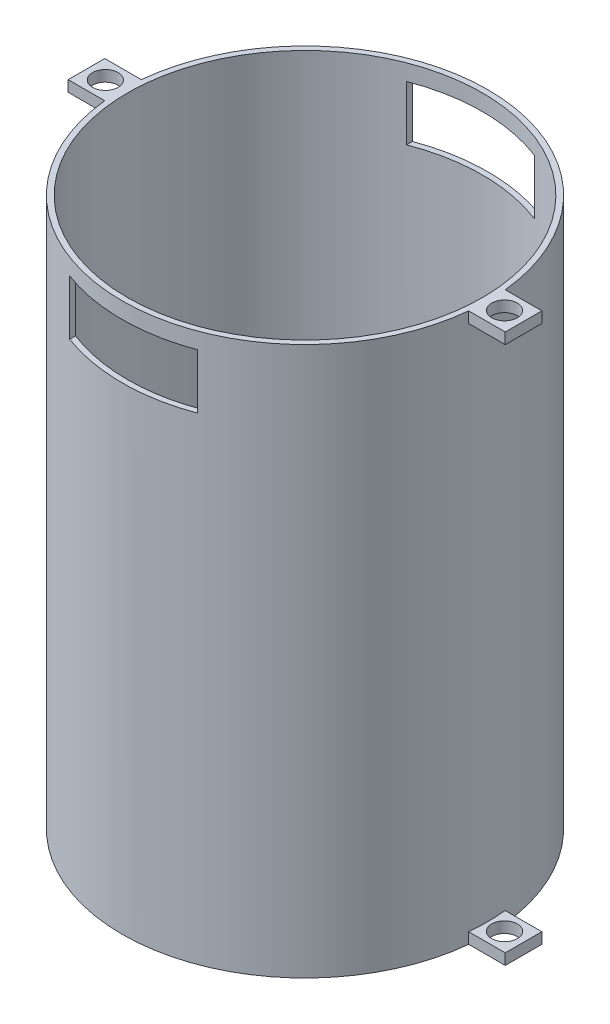
from build123d import *

# Parameters (mm, degrees)
SKETCH2_R               = 50
BOSS_EXTRUDE1_DEPTH     = 150
SKETCH3_R               = 48
CUT_EXTRUDE1_DEPTH      = 150
SKETCH4_W               = 10
SKETCH4_H               = 10
BOSS_EXTRUDE2_DEPTH     = 3
SKETCH5_W               = 10
SKETCH5_H               = 10
BOSS_EXTRUDE3_DEPTH     = 3
SKETCH7_W               = 10
SKETCH7_H               = 10
BOSS_EXTRUDE5_DEPTH     = 3
SKETCH8_W               = 10
SKETCH8_H               = 10
BOSS_EXTRUDE6_DEPTH     = 3
SKETCH9_R               = 3.5
CUT_EXTRUDE2_DEPTH      = 200
SKETCH10_R              = 3.5
CUT_EXTRUDE3_DEPTH      = 200
CUT_EXTRUDE4_DEPTH      = 150
CUT_EXTRUDE4_DEPTH_BACK = 150
SKETCH11_W              = 35
SKETCH11_H              = 15
SKETCH12_R              = 48.5
CUT_EXTRUDE5_DEPTH      = 150


with BuildPart() as part:
    # Sketch2 → Boss-Extrude1 (new body)
    with BuildSketch(Plane(origin=(0, 0, 0), x_dir=(1, 0, 0), z_dir=(0, 1, 0))):
        with Locations(Location((0, 0, 0), (0, 0, 270))):
            Circle(SKETCH2_R)
    extrude(amount=BOSS_EXTRUDE1_DEPTH)

    # Sketch3 → Cut-Extrude1 (cut)
    with BuildSketch(Plane(origin=(0, 150, 0), x_dir=(1, 0, 0), z_dir=(0, 1, 0))):
        with Locations(Location((0, 0, 0), (0, 0, 270))):
            Circle(SKETCH3_R)
    extrude(amount=-CUT_EXTRUDE1_DEPTH, mode=Mode.SUBTRACT)

    # Sketch4 → Boss-Extrude2 (add)
    with BuildSketch(Plane(origin=(0, 150, 0), x_dir=(1, 0, 0), z_dir=(0, 1, 0))):
        with Locations((54.749371855, 0)):
            Rectangle(SKETCH4_W, SKETCH4_H)
    extrude(amount=-BOSS_EXTRUDE2_DEPTH)

    # Sketch5 → Boss-Extrude3 (add)
    with BuildSketch(Plane(origin=(0, 150, 0), x_dir=(1, 0, 0), z_dir=(0, 1, 0))):
        with Locations((-54.749371855, 0)):
            Rectangle(SKETCH5_W, SKETCH5_H)
    extrude(amount=-BOSS_EXTRUDE3_DEPTH)

    # Sketch7 → Boss-Extrude5 (add)
    with BuildSketch(Plane(origin=(0, 0, 0), x_dir=(1, 0, 0), z_dir=(0, 1, 0))):
        with Locations((-54.749371855, 0)):
            Rectangle(SKETCH7_W, SKETCH7_H)
    extrude(amount=BOSS_EXTRUDE5_DEPTH)

    # Sketch8 → Boss-Extrude6 (add)
    with BuildSketch(Plane(origin=(0, 0, 0), x_dir=(-1, 0, 0), z_dir=(0, -1, 0))):
        with Locations((-54.749371855, 0)):
            Rectangle(SKETCH8_W, SKETCH8_H)
    extrude(amount=-BOSS_EXTRUDE6_DEPTH)

    # Sketch9 → Cut-Extrude2 (cut)
    with BuildSketch(Plane.XZ):
        with Locations(Location((54.545191051, 0, 0), (0, 0, 270))):
            Circle(SKETCH9_R)
    extrude(amount=-CUT_EXTRUDE2_DEPTH, mode=Mode.SUBTRACT)

    # Sketch10 → Cut-Extrude3 (cut)
    with BuildSketch(Plane(origin=(0, 0, 0), x_dir=(-1, 0, 0), z_dir=(0, -1, 0))):
        with Locations(Location((54.586012061, 0, 0), (0, 0, 90))):
            Circle(SKETCH10_R)
    extrude(amount=-CUT_EXTRUDE3_DEPTH, mode=Mode.SUBTRACT)

    # Sketch11 → Cut-Extrude4 (cut, two sides: drawn at the far end of the back side and taken through both)
    with BuildSketch(Plane.XY.offset(-CUT_EXTRUDE4_DEPTH_BACK)):
        with Locations((0, 138.072258372)):
            Rectangle(SKETCH11_W, SKETCH11_H)
    extrude(amount=CUT_EXTRUDE4_DEPTH + CUT_EXTRUDE4_DEPTH_BACK, mode=Mode.SUBTRACT)

    # Sketch12 → Cut-Extrude5 (cut)
    with BuildSketch(Plane(origin=(0, 150, 0), x_dir=(1, 0, 0), z_dir=(0, 1, 0))):
        with Locations(Location((0, 0, 0), (0, 0, 270))):
            Circle(SKETCH12_R)
    extrude(amount=-CUT_EXTRUDE5_DEPTH, mode=Mode.SUBTRACT)


solid = part.part
